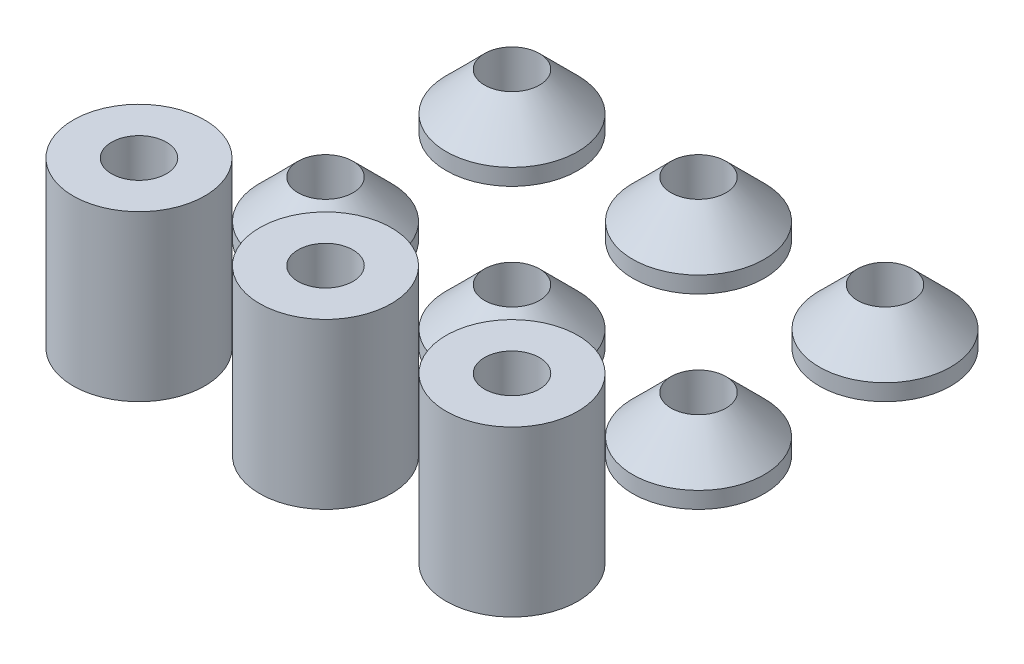
from build123d import *

# Parameters (mm, degrees)
CROQUIS5_R              = 6
SALIENTE_EXTRUIR3_DEPTH = 4
CROQUIS6_R              = 2.5
CORTAR_EXTRUIR3_DEPTH   = 4
SALIENTE_EXTRUIR4_START = 1
CROQUIS7_R              = 3.5
CROQUIS7_R_2            = 2.5
SALIENTE_EXTRUIR4_DEPTH = 1
MATRIZL1_COUNT          = 3
MATRIZL1_PITCH          = 17
MATRIZL1_2_COUNT        = 2
MATRIZL1_2_PITCH        = 17
CROQUIS11_R             = 6
CROQUIS11_R_2           = 2.5
SALIENTE_EXTRUIR5_DEPTH = 15
MATRIZL2_COUNT          = 3
MATRIZL2_PITCH          = 17


with BuildPart() as part:
    # Croquis5 → Saliente-Extruir3 (new body)
    with BuildSketch(Plane(origin=(0, 0, 0), x_dir=(1, 0, 0), z_dir=(0, 1, 0))):
        with Locations(Location((-13.521991575, 0, 0), (0, 0, 270))):
            Circle(CROQUIS5_R)
    extrude(amount=SALIENTE_EXTRUIR3_DEPTH)

    # Croquis6 → Cortar-Extruir3 (cut)
    with BuildSketch(Plane(origin=(0, 4, 0), x_dir=(1, 0, 0), z_dir=(0, 1, 0))):
        with Locations(Location((-13.521991575, 0, 0), (0, 0, 270))):
            Circle(CROQUIS6_R)
    extrude(amount=-CORTAR_EXTRUIR3_DEPTH, mode=Mode.SUBTRACT)

    # Croquis7 → Saliente-Extruir4 (add)
    with BuildSketch(Plane(origin=(0, 4, 0), x_dir=(1, 0, 0), z_dir=(0, 1, 0)).offset(SALIENTE_EXTRUIR4_START)):
        with Locations(Location((-13.521991575, 0, 0), (0, 0, 270))):
            Circle(CROQUIS7_R)
        with Locations(Location((-13.521991575, 0, 0), (0, 0, 270))):
            Circle(CROQUIS7_R_2, mode=Mode.SUBTRACT)
    extrude(amount=-SALIENTE_EXTRUIR4_DEPTH)

    # Croquis9 → Cortar-Revolución4 (revolve, cut)
    with BuildSketch(Plane.XY, mode=Mode.PRIVATE) as cortar_revoluci_n4_sk:
        Polygon((-19.521991575, 1.5), (-16.021991575, 5), (-19.521991575, 5), align=None)
    revolve(cortar_revoluci_n4_sk.sketch.rotate(Axis((-13.521991575, 0, 0), (0, 1, 0)), 270), axis=Axis((-13.521991575, 0, 0), (0, 1, 0)), mode=Mode.SUBTRACT)


with BuildPart() as matrizl1_1:
    # MatrizL1: pattern copy
    add(part.part.moved(Location(Vector(1, 0, 0) * (1 * MATRIZL1_PITCH))))


with BuildPart() as matrizl1_2:
    # MatrizL1: pattern copy
    add(part.part.moved(Location(Vector(1, 0, 0) * (2 * MATRIZL1_PITCH))))


with BuildPart() as matrizl1_2_1:
    # MatrizL1 2: pattern copy
    add(part.part.moved(Location(Vector(0, 0, 1) * (1 * MATRIZL1_2_PITCH))))


with BuildPart() as matrizl1_2_2:
    # MatrizL1 2: pattern copy
    add(matrizl1_1.part.moved(Location(Vector(0, 0, 1) * (1 * MATRIZL1_2_PITCH))))


with BuildPart() as matrizl1_2_3:
    # MatrizL1 2: pattern copy
    add(matrizl1_2.part.moved(Location(Vector(0, 0, 1) * (1 * MATRIZL1_2_PITCH))))


with BuildPart() as body_7:
    # Croquis11 → Saliente-Extruir5 (new body)
    with BuildSketch(Plane(origin=(0, 0, 0), x_dir=(1, 0, 0), z_dir=(0, 1, 0))):
        with Locations(Location((-13.521991575, -34, 0), (0, 0, 270))):
            Circle(CROQUIS11_R)
        with Locations(Location((-13.521991575, -34, 0), (0, 0, 270))):
            Circle(CROQUIS11_R_2, mode=Mode.SUBTRACT)
    saliente_extruir5 = extrude(amount=SALIENTE_EXTRUIR5_DEPTH)


with BuildPart() as matrizl2_1:
    # MatrizL2: Saliente-Extruir5 ×3
    with Locations(*[(i * MATRIZL2_PITCH, 0, 0) for i in range(1, MATRIZL2_COUNT)]):
        add(saliente_extruir5)


solid = Compound([part.part, matrizl1_1.part, matrizl1_2.part, matrizl1_2_1.part, matrizl1_2_2.part, matrizl1_2_3.part, body_7.part, matrizl2_1.part])
